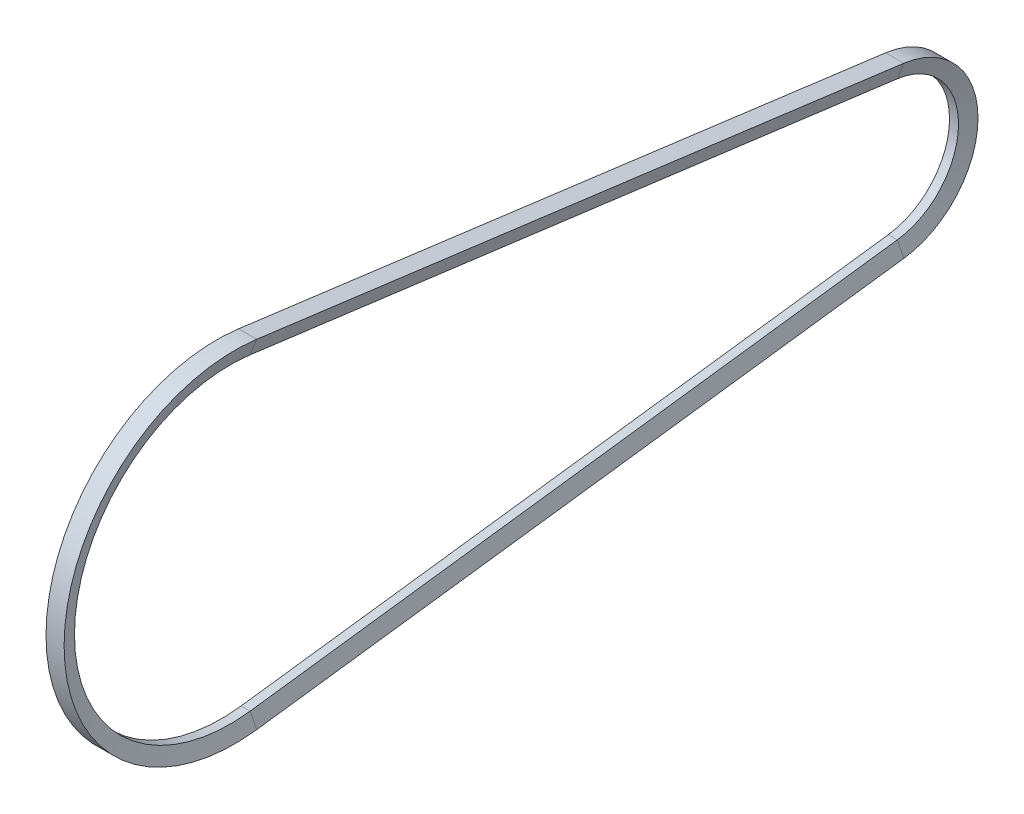
from build123d import *


with BuildPart() as part:
    # 扫描1: sweep along a path in 草图1
    with BuildLine(Plane(origin=(0, 0, 0), x_dir=(0, 0, -1), z_dir=(1, 0, 0))) as sweep_1_path:
        Line((10.361352156, 79.326177152), (314.020676078, 39.663088576))
        ThreePointArc((314.020676078, 39.663088576), (348.84, 0), (314.020676078, -39.663088576))
        Line((314.020676078, -39.663088576), (10.361352156, -79.326177152))
        ThreePointArc((10.361352156, -79.326177152), (-80, 0), (10.361352156, 79.326177152))
    # 草图2 → 扫描1 (sweep)
    with BuildSketch(Plane.XY):
        Polygon((-4.25, 80), (4.25, 80), (2.10988523, 73), (-2.10988523, 73), align=None)
    sweep(path=sweep_1_path.line)


solid = part.part
